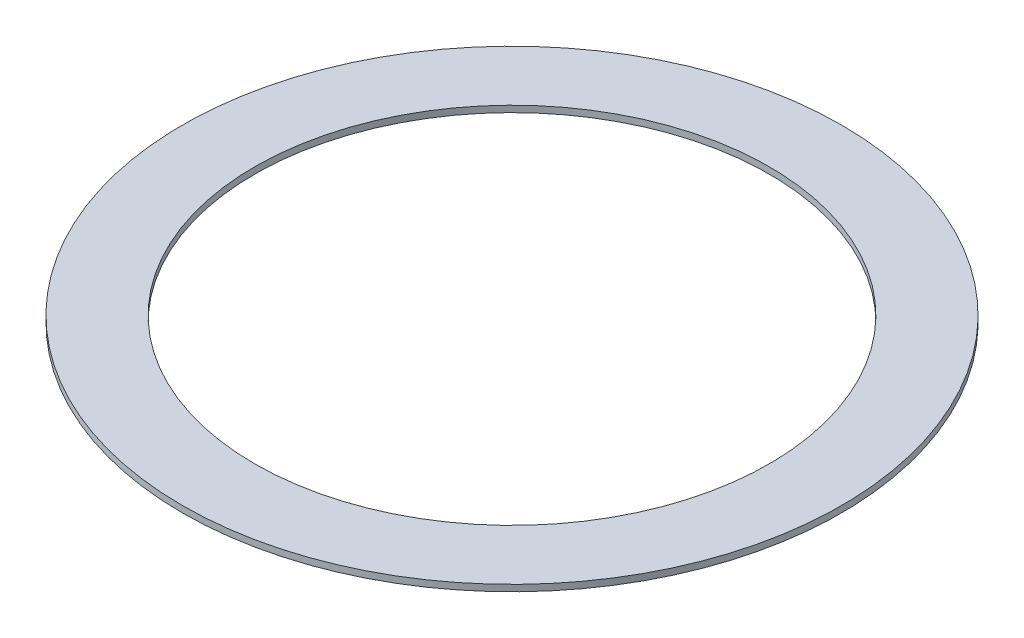
from build123d import *

# Parameters (mm, degrees)
SKETCH1_R           = 41.021
SKETCH1_R_2         = 32.0294
BOSS_EXTRUDE1_DEPTH = 0.40005


with BuildPart() as part:
    # Sketch1 → Boss-Extrude1 (new, symmetric)
    with BuildSketch(Plane(origin=(0, 0, 0), x_dir=(1, 0, 0), z_dir=(0, 1, 0))):
        with Locations(Location((0, 0, 0), (0, 0, 270))):
            Circle(SKETCH1_R)
        with Locations(Location((0, 0, 0), (0, 0, 270))):
            Circle(SKETCH1_R_2, mode=Mode.SUBTRACT)
    extrude(amount=BOSS_EXTRUDE1_DEPTH, both=True)


solid = part.part
